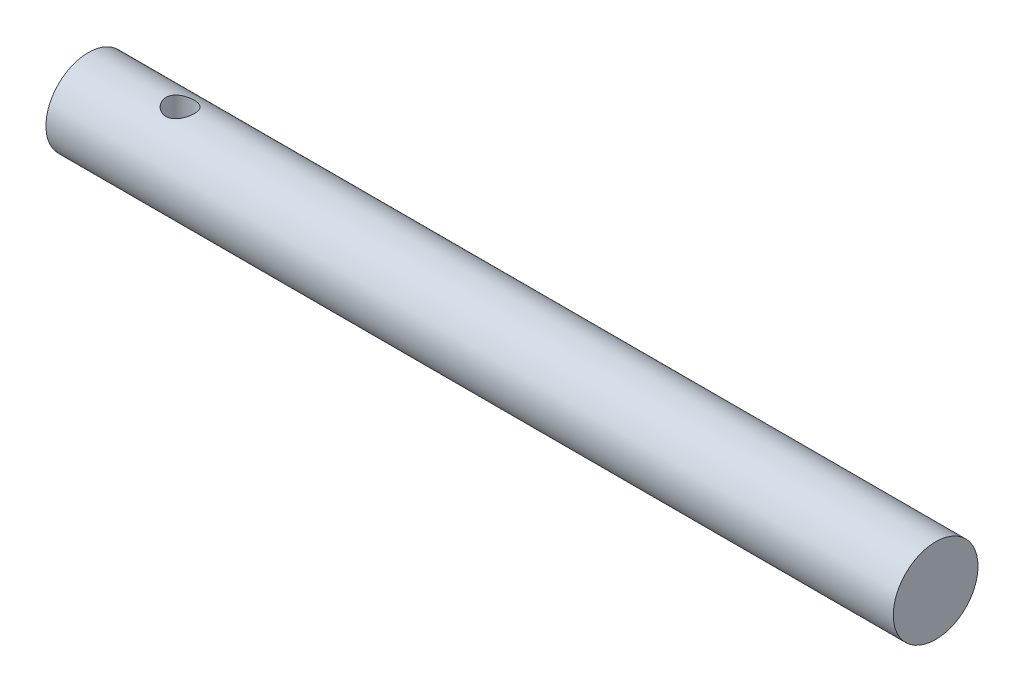
from build123d import *

# Parameters (mm, degrees)
M6_THREADED_STOCK_ENVELOPE_SKETCH_R = 3
M6_THREADED_STOCK_ENVELOPE_DEPTH    = 60
COUPLING_PIN_CROSS_HOLE_SKETCH_R    = 1
COUPLING_PIN_CROSS_HOLE_DEPTH       = 8


with BuildPart() as part:
    # M6 threaded stock envelope sketch → M6 threaded stock envelope (new body)
    with BuildSketch(Plane(origin=(2.5, 0, 0), x_dir=(0, 0, -1), z_dir=(1, 0, 0))):
        with Locations((19.5, -29)):
            Circle(M6_THREADED_STOCK_ENVELOPE_SKETCH_R)
    extrude(amount=M6_THREADED_STOCK_ENVELOPE_DEPTH)

    # Coupling pin cross hole sketch → Coupling pin cross hole (cut)
    with BuildSketch(Plane(origin=(0, -33, 0), x_dir=(1, 0, 0), z_dir=(0, 1, 0))):
        with Locations(Location((9, 19.5, 0), (0, 0, 90))):
            Circle(COUPLING_PIN_CROSS_HOLE_SKETCH_R)
    extrude(amount=COUPLING_PIN_CROSS_HOLE_DEPTH, mode=Mode.SUBTRACT)


solid = part.part
